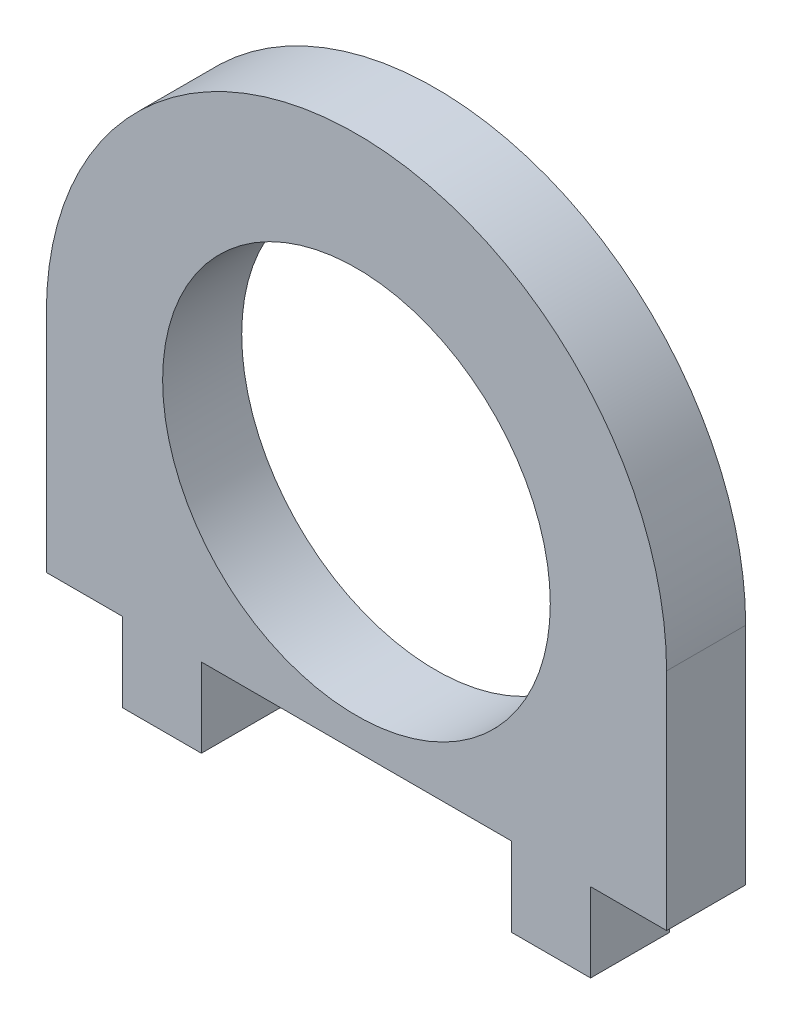
from build123d import *

# Parameters (mm, degrees)
SKETCH1_R           = 12.5
BOSS_EXTRUDE1_DEPTH = 5.1


with BuildPart() as part:
    # Sketch1 → Boss-Extrude1 (new body)
    with BuildSketch(Plane.XY):
        with BuildLine():
            Line((0, 0), (-4.9, 0))
            Line((-4.9, 0), (-4.9, -5.1))
            Line((-4.9, -5.1), (-10, -5.1))
            Line((-10, -5.1), (-10, 0))
            Line((-10, 0), (-30, 0))
            Line((-30, 0), (-30, -5.1))
            Line((-30, -5.1), (-35.1, -5.1))
            Line((-35.1, -5.1), (-35.1, 0))
            Line((-35.1, 0), (-40, 0))
            Line((-40, 0), (-40, 14.5))
            ThreePointArc((-40, 14.5), (-20, 34.5), (0, 14.5))
            Line((0, 14.5), (0, 0))
        make_face()
        with Locations((-20, 14.5)):
            Circle(SKETCH1_R, mode=Mode.SUBTRACT)
    extrude(amount=BOSS_EXTRUDE1_DEPTH)


solid = part.part
